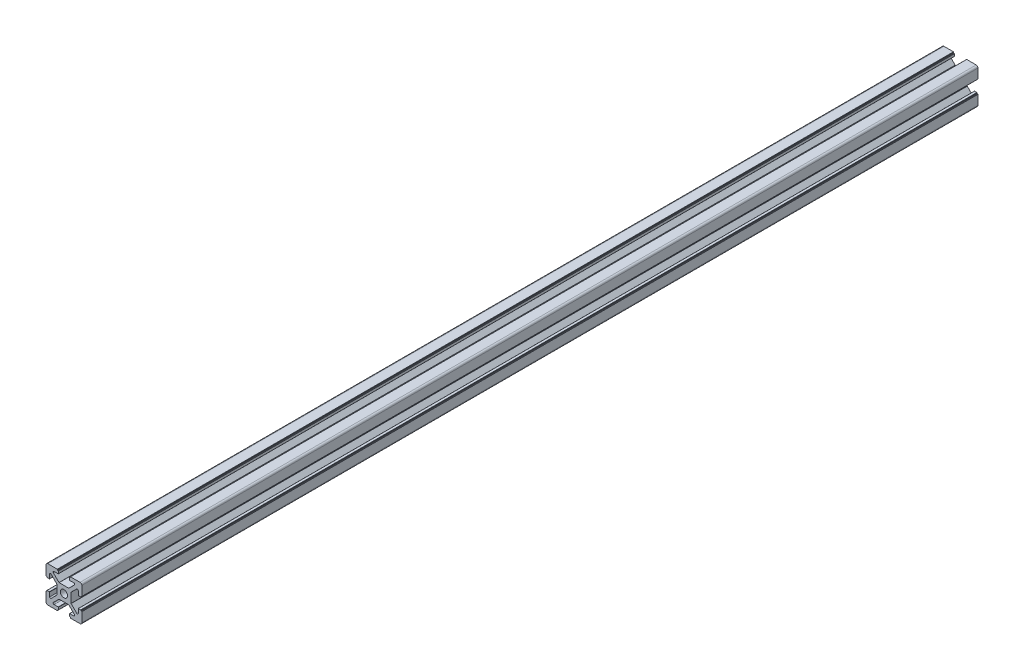
from build123d import *

# Parameters (mm, degrees)
SKETCH1_R           = 2
BOSS_EXTRUDE1_DEPTH = 500


with BuildPart() as part:
    # Sketch1 → Boss-Extrude1 (new body)
    with BuildSketch(Plane.XY):
        with BuildLine():
            Line((-10, 9), (-10, 3.7))
            ThreePointArc((-10, 3.7), (-9.970710678, 3.629289322), (-9.9, 3.6))
            Line((-9.9, 3.6), (-9.6, 3.6))
            ThreePointArc((-9.6, 3.6), (-9.529289322, 3.570710678), (-9.5, 3.5))
            Line((-9.5, 3.5), (-9.5, 3.2))
            ThreePointArc((-9.5, 3.2), (-9.470710678, 3.129289322), (-9.4, 3.1))
            Line((-9.4, 3.1), (-8.1, 3.1))
            ThreePointArc((-8.1, 3.1), (-8.029289322, 3.129289322), (-8, 3.2))
            Line((-8, 3.2), (-8, 5.520101013))
            ThreePointArc((-8, 5.520101013), (-7.691341716, 5.982040779), (-7.146446609, 5.873654403))
            Line((-7.146446609, 5.873654403), (-4.029289322, 2.756497116))
            ThreePointArc((-4.029289322, 2.756497116), (-4.007612047, 2.724054781), (-4, 2.685786438))
            Line((-4, 2.685786438), (-4, 0))
            Line((-4, 0), (-4, -2.685786438))
            ThreePointArc((-4, -2.685786438), (-4.007612047, -2.724054781), (-4.029289322, -2.756497116))
            Line((-4.029289322, -2.756497116), (-7.146446609, -5.873654403))
            ThreePointArc((-7.146446609, -5.873654403), (-7.691341716, -5.982040779), (-8, -5.520101013))
            Line((-8, -5.520101013), (-8, -3.2))
            ThreePointArc((-8, -3.2), (-8.029289322, -3.129289322), (-8.1, -3.1))
            Line((-8.1, -3.1), (-9.4, -3.1))
            ThreePointArc((-9.4, -3.1), (-9.470710678, -3.129289322), (-9.5, -3.2))
            Line((-9.5, -3.2), (-9.5, -3.5))
            ThreePointArc((-9.5, -3.5), (-9.529289322, -3.570710678), (-9.6, -3.6))
            Line((-9.6, -3.6), (-9.9, -3.6))
            ThreePointArc((-9.9, -3.6), (-9.970710678, -3.629289322), (-10, -3.7))
            Line((-10, -3.7), (-10, -9))
            ThreePointArc((-10, -9), (-9.707106781, -9.707106781), (-9, -10))
            Line((-9, -10), (-3.7, -10))
            ThreePointArc((-3.7, -10), (-3.629289322, -9.970710678), (-3.6, -9.9))
            Line((-3.6, -9.9), (-3.6, -9.6))
            ThreePointArc((-3.6, -9.6), (-3.570710678, -9.529289322), (-3.5, -9.5))
            Line((-3.5, -9.5), (-3.2, -9.5))
            ThreePointArc((-3.2, -9.5), (-3.129289322, -9.470710678), (-3.1, -9.4))
            Line((-3.1, -9.4), (-3.1, -8.1))
            ThreePointArc((-3.1, -8.1), (-3.129289322, -8.029289322), (-3.2, -8))
            Line((-3.2, -8), (-5.520101013, -8))
            ThreePointArc((-5.520101013, -8), (-5.982040779, -7.691341716), (-5.873654403, -7.146446609))
            Line((-5.873654403, -7.146446609), (-2.756497116, -4.029289322))
            ThreePointArc((-2.756497116, -4.029289322), (-2.724054781, -4.007612047), (-2.685786438, -4))
            Line((-2.685786438, -4), (2.685786438, -4))
            ThreePointArc((2.685786438, -4), (2.724054781, -4.007612047), (2.756497116, -4.029289322))
            Line((2.756497116, -4.029289322), (5.873654403, -7.146446609))
            ThreePointArc((5.873654403, -7.146446609), (5.982040779, -7.691341716), (5.520101013, -8))
            Line((5.520101013, -8), (3.2, -8))
            ThreePointArc((3.2, -8), (3.129289322, -8.029289322), (3.1, -8.1))
            Line((3.1, -8.1), (3.1, -9.4))
            ThreePointArc((3.1, -9.4), (3.129289322, -9.470710678), (3.2, -9.5))
            Line((3.2, -9.5), (3.5, -9.5))
            ThreePointArc((3.5, -9.5), (3.570710678, -9.529289322), (3.6, -9.6))
            Line((3.6, -9.6), (3.6, -9.9))
            ThreePointArc((3.6, -9.9), (3.629289322, -9.970710678), (3.7, -10))
            Line((3.7, -10), (9, -10))
            ThreePointArc((9, -10), (9.707106781, -9.707106781), (10, -9))
            Line((10, -9), (10, -3.7))
            ThreePointArc((10, -3.7), (9.970710678, -3.629289322), (9.9, -3.6))
            Line((9.9, -3.6), (9.6, -3.6))
            ThreePointArc((9.6, -3.6), (9.529289322, -3.570710678), (9.5, -3.5))
            Line((9.5, -3.5), (9.5, -3.2))
            ThreePointArc((9.5, -3.2), (9.470710678, -3.129289322), (9.4, -3.1))
            Line((9.4, -3.1), (8.1, -3.1))
            ThreePointArc((8.1, -3.1), (8.029289322, -3.129289322), (8, -3.2))
            Line((8, -3.2), (8, -5.520101013))
            ThreePointArc((8, -5.520101013), (7.691341716, -5.982040779), (7.146446609, -5.873654403))
            Line((7.146446609, -5.873654403), (4.029289322, -2.756497116))
            ThreePointArc((4.029289322, -2.756497116), (4.007612047, -2.724054781), (4, -2.685786438))
            Line((4, -2.685786438), (4, 0))
            Line((4, 0), (4, 2.685786438))
            ThreePointArc((4, 2.685786438), (4.007612047, 2.724054781), (4.029289322, 2.756497116))
            Line((4.029289322, 2.756497116), (7.146446609, 5.873654403))
            ThreePointArc((7.146446609, 5.873654403), (7.691341716, 5.982040779), (8, 5.520101013))
            Line((8, 5.520101013), (8, 3.2))
            ThreePointArc((8, 3.2), (8.029289322, 3.129289322), (8.1, 3.1))
            Line((8.1, 3.1), (9.4, 3.1))
            ThreePointArc((9.4, 3.1), (9.470710678, 3.129289322), (9.5, 3.2))
            Line((9.5, 3.2), (9.5, 3.5))
            ThreePointArc((9.5, 3.5), (9.529289322, 3.570710678), (9.6, 3.6))
            Line((9.6, 3.6), (9.9, 3.6))
            ThreePointArc((9.9, 3.6), (9.970710678, 3.629289322), (10, 3.7))
            Line((10, 3.7), (10, 9))
            ThreePointArc((10, 9), (9.707106781, 9.707106781), (9, 10))
            Line((9, 10), (3.7, 10))
            ThreePointArc((3.7, 10), (3.629289322, 9.970710678), (3.6, 9.9))
            Line((3.6, 9.9), (3.6, 9.6))
            ThreePointArc((3.6, 9.6), (3.570710678, 9.529289322), (3.5, 9.5))
            Line((3.5, 9.5), (3.2, 9.5))
            ThreePointArc((3.2, 9.5), (3.129289322, 9.470710678), (3.1, 9.4))
            Line((3.1, 9.4), (3.1, 8.1))
            ThreePointArc((3.1, 8.1), (3.129289322, 8.029289322), (3.2, 8))
            Line((3.2, 8), (5.520101013, 8))
            ThreePointArc((5.520101013, 8), (5.982040779, 7.691341716), (5.873654403, 7.146446609))
            Line((5.873654403, 7.146446609), (2.756497116, 4.029289322))
            ThreePointArc((2.756497116, 4.029289322), (2.724054781, 4.007612047), (2.685786438, 4))
            Line((2.685786438, 4), (-2.685786438, 4))
            ThreePointArc((-2.685786438, 4), (-2.724054781, 4.007612047), (-2.756497116, 4.029289322))
            Line((-2.756497116, 4.029289322), (-5.873654403, 7.146446609))
            ThreePointArc((-5.873654403, 7.146446609), (-5.982040779, 7.691341716), (-5.520101013, 8))
            Line((-5.520101013, 8), (-3.2, 8))
            ThreePointArc((-3.2, 8), (-3.129289322, 8.029289322), (-3.1, 8.1))
            Line((-3.1, 8.1), (-3.1, 9.4))
            ThreePointArc((-3.1, 9.4), (-3.129289322, 9.470710678), (-3.2, 9.5))
            Line((-3.2, 9.5), (-3.5, 9.5))
            ThreePointArc((-3.5, 9.5), (-3.570710678, 9.529289322), (-3.6, 9.6))
            Line((-3.6, 9.6), (-3.6, 9.9))
            ThreePointArc((-3.6, 9.9), (-3.629289322, 9.970710678), (-3.7, 10))
            Line((-3.7, 10), (-9, 10))
            ThreePointArc((-9, 10), (-9.707106781, 9.707106781), (-10, 9))
        make_face()
        Circle(SKETCH1_R, mode=Mode.SUBTRACT)
    extrude(amount=BOSS_EXTRUDE1_DEPTH)


solid = part.part
